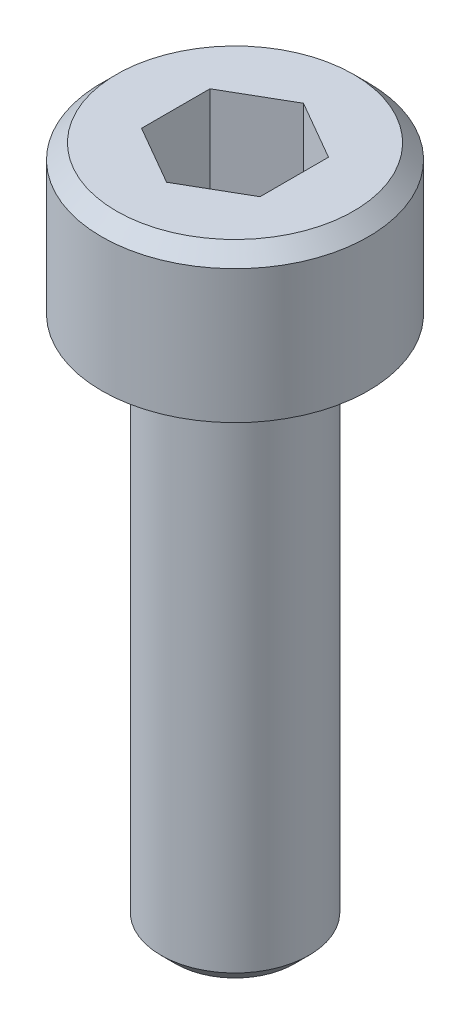
from build123d import *

# Parameters (mm, degrees)
CUT_EXTRUDE1_DEPTH = 4
CHAMFER1_SIZE      = 0.5
CHAMFER2_SIZE      = 0.5


with BuildPart() as part:
    # Sketch1 → Revolve1 (revolve)
    with BuildSketch(Plane.XY, mode=Mode.PRIVATE) as revolve1_sk:
        Polygon((0, 11.5), (4.5, 11.5), (4.5, 6.5), (2.5, 6.5), (2.5, -11.5), (0, -11.5), align=None)
    revolve(revolve1_sk.sketch.rotate(Axis((0, 14.918478261, 0), (0, -1, 0)), 90), axis=Axis((0, 14.918478261, 0), (0, -1, 0)))

    # Sketch2 → Cut-Extrude1 (cut)
    with BuildSketch(Plane(origin=(0, 11.5, 0), x_dir=(1, 0, 0), z_dir=(0, 1, 0))):
        Polygon((0, 2.309401077), (-2, 1.154700538), (-2, -1.154700538), (0, -2.309401077), (2, -1.154700538), (2, 1.154700538), align=None)
    extrude(amount=-CUT_EXTRUDE1_DEPTH, mode=Mode.SUBTRACT)

    # Chamfer1
    chamfer1_edges = [part.edges().sort_by_distance(p)[0] for p in [
        (0, 11.5, -4.5),
    ]]
    chamfer(chamfer1_edges, length=CHAMFER1_SIZE)

    # Chamfer2
    chamfer2_edges = [part.edges().sort_by_distance(p)[0] for p in [
        (0, -11.5, -2.5),
    ]]
    chamfer(chamfer2_edges, length=CHAMFER2_SIZE)


solid = part.part
